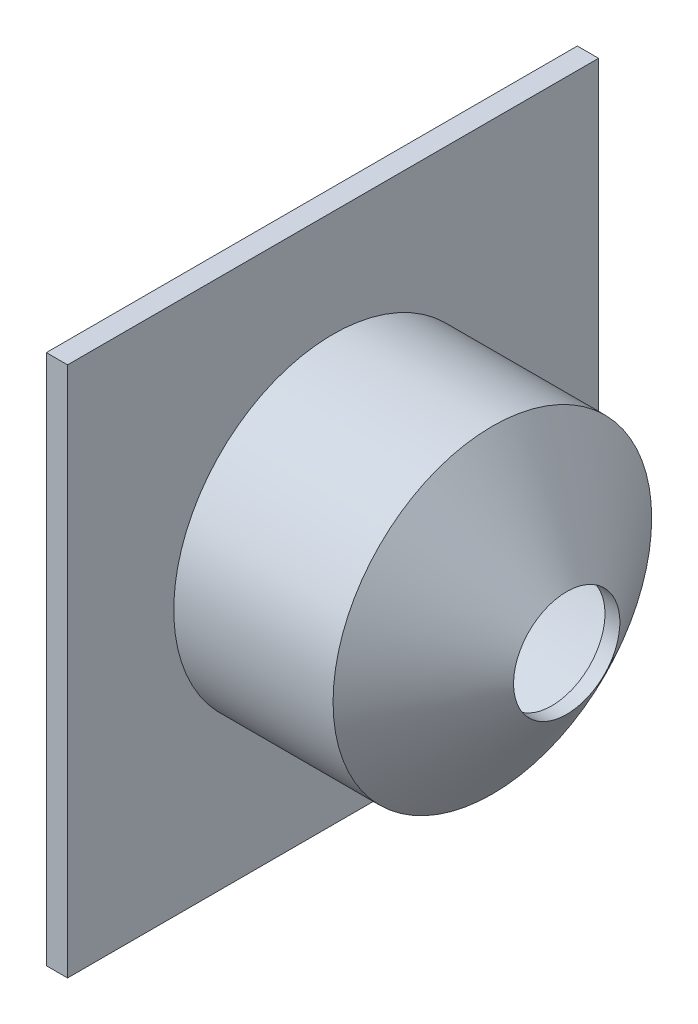
from build123d import *

# Parameters (mm, degrees)
SKETCH1_R           = 15
SKETCH1_R_2         = 13
BOSS_EXTRUDE1_DEPTH = 17
SKETCH1_4_W         = 50
SKETCH1_4_H         = 50
SKETCH1_4_R         = 15
BOSS_EXTRUDE2_DEPTH = 2


with BuildPart() as part:
    # Sketch1 → Boss-Extrude1 (new body)
    with BuildSketch(Plane(origin=(0, 0, 0), x_dir=(0, 0, -1), z_dir=(1, 0, 0))):
        Circle(SKETCH1_R)
        Circle(SKETCH1_R_2, mode=Mode.SUBTRACT)
    extrude(amount=BOSS_EXTRUDE1_DEPTH)

    # Sketch5 → Revolve1 (revolve)
    with BuildSketch(Plane(origin=(0, 0, 0), x_dir=(1, 0, 0), z_dir=(0, 1, 0))):
        Polygon((17, 15), (23.997632523, 5.00634506), (22.597217447, 5.00634506), (17, 13), align=None)
    revolve(axis=Axis((-1.32201978, 0, 0), (1, 0, 0)))


with BuildPart() as body_2:
    # Sketch1<4> → Boss-Extrude2 (new body)
    with BuildSketch(Plane(origin=(0, 0, 0), x_dir=(0, 0, -1), z_dir=(1, 0, 0))):
        Rectangle(SKETCH1_4_W, SKETCH1_4_H)
        Circle(SKETCH1_4_R, mode=Mode.SUBTRACT)
    extrude(amount=BOSS_EXTRUDE2_DEPTH)


solid = Compound([part.part, body_2.part])
